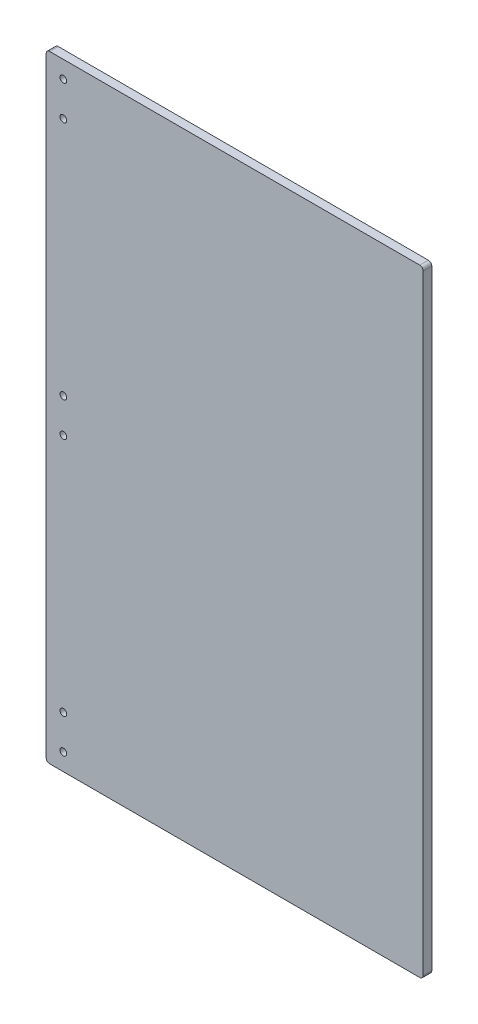
from build123d import *

# Parameters (mm, degrees)
SKETCH1_W           = 279.4
SKETCH1_H           = 457.2
SKETCH1_R           = 2.5
BOSS_EXTRUDE1_DEPTH = 6.35
FILLET1_R           = 2.54


with BuildPart() as part:
    # Sketch1 → Boss-Extrude1 (new body)
    with BuildSketch(Plane.XY):
        with Locations((139.7, 228.6)):
            Rectangle(SKETCH1_W, SKETCH1_H)
        with Locations((12.7, 444.5)):
            Circle(SKETCH1_R, mode=Mode.SUBTRACT)
        with Locations((12.7, 419.1)):
            Circle(SKETCH1_R, mode=Mode.SUBTRACT)
        with Locations((12.7, 241.3)):
            Circle(SKETCH1_R, mode=Mode.SUBTRACT)
        with Locations((12.7, 215.9)):
            Circle(SKETCH1_R, mode=Mode.SUBTRACT)
        with Locations((12.7, 38.1)):
            Circle(SKETCH1_R, mode=Mode.SUBTRACT)
        with Locations((12.7, 12.7)):
            Circle(SKETCH1_R, mode=Mode.SUBTRACT)
    extrude(amount=BOSS_EXTRUDE1_DEPTH)

    # Fillet1
    fillet1_edges = [part.edges().sort_by_distance(p)[0] for p in [
        (0, 457.2, 3.175),
        (279.4, 457.2, 3.175),
        (279.4, 0, 3.175),
        (0, 0, 3.175),
    ]]
    fillet(fillet1_edges, radius=FILLET1_R)


solid = part.part
